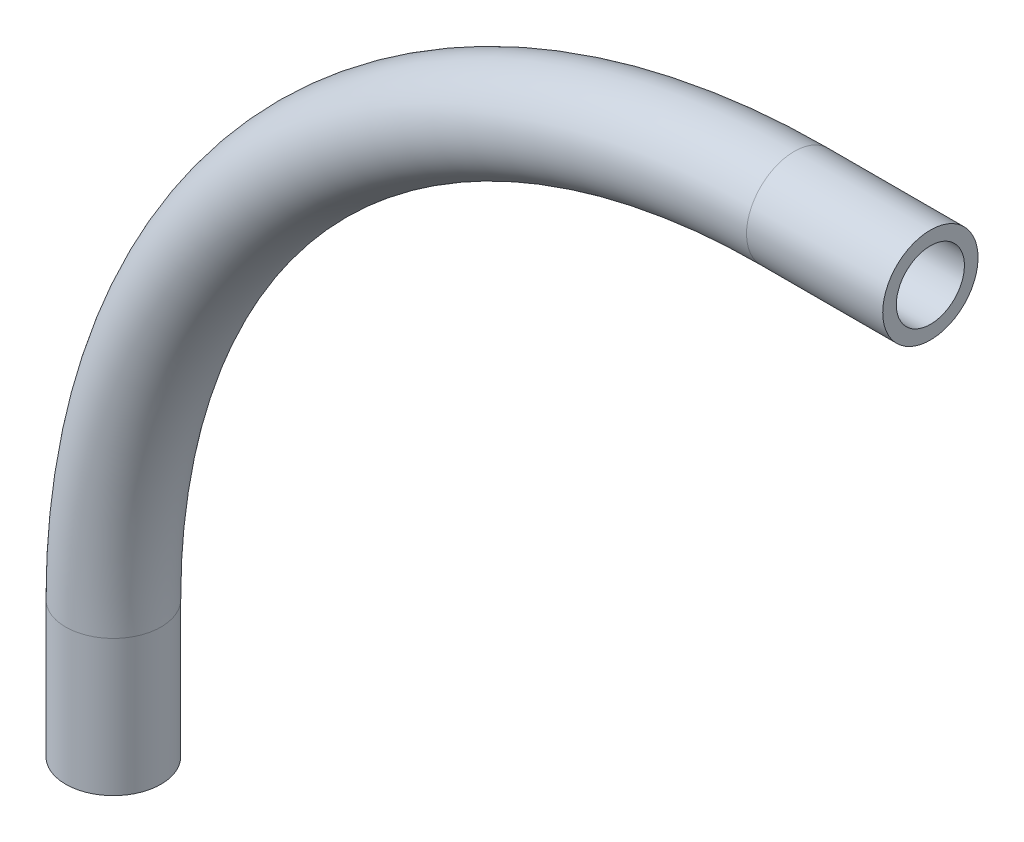
from build123d import *

# Parameters (mm, degrees)
SWEEP1_PROFILE_R     = 3.5
CUT_SWEEP1_PROFILE_R = 2.5


with BuildPart() as part:
    # Sweep1: sweep along a path in Sketch1
    with BuildLine(Plane.XY) as sweep1_path:
        Line((10, 50), (0, 50))
        ThreePointArc((0, 50), (-35.355339059, 35.355339059), (-50, 0))
        Line((-50, 0), (-50, -10))
    # Sweep1 profile (on start of the path) → Sweep1 (sweep)
    with BuildSketch(Plane(origin=(10, 50, 0), x_dir=(0, 0, -1), z_dir=(-1, 0, 0))):
        Circle(SWEEP1_PROFILE_R)
    sweep(path=sweep1_path.line)

    # Cut-Sweep1: sweep along a path in Sketch1<2>
    with BuildLine(Plane.XY) as cut_sweep1_path:
        Line((10, 50), (0, 50))
        ThreePointArc((0, 50), (-35.355339059, 35.355339059), (-50, 0))
        Line((-50, 0), (-50, -10))
    # Cut-Sweep1 profile (on start of the path) → Cut-Sweep1 (sweep, cut)
    with BuildSketch(Plane(origin=(10, 50, 0), x_dir=(0, 0, -1), z_dir=(-1, 0, 0))):
        Circle(CUT_SWEEP1_PROFILE_R)
    sweep(path=cut_sweep1_path.line, mode=Mode.SUBTRACT)


solid = part.part
